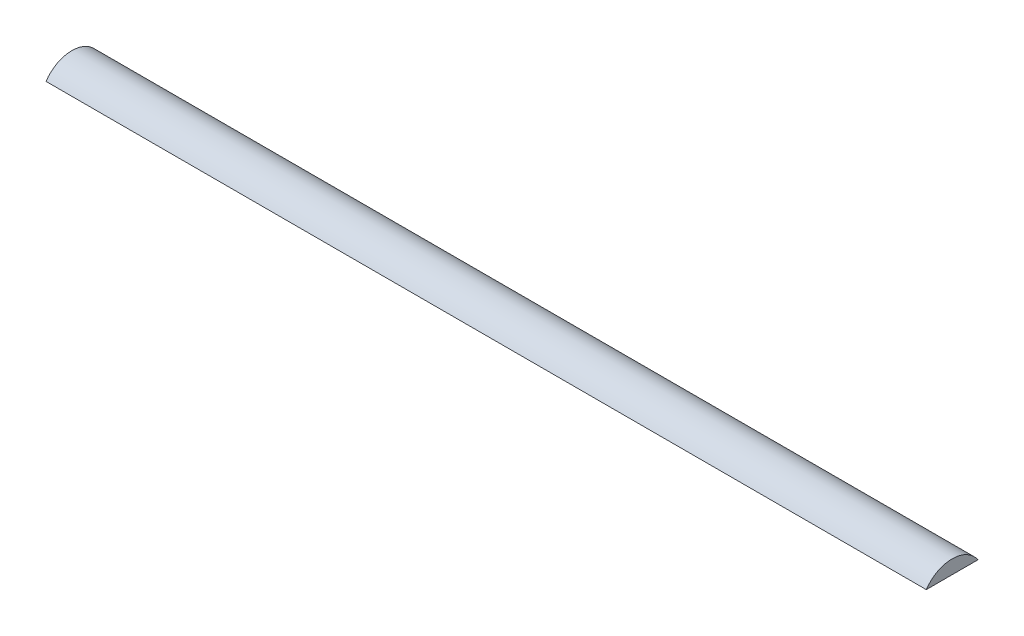
from build123d import *

# Parameters (mm, degrees)
EXTRUDE_1_DEPTH = 800


with BuildPart() as part:
    # 草图1 → 凸台-拉伸1 (new body)
    with BuildSketch(Plane(origin=(0, 0, 0), x_dir=(0, 0, -1), z_dir=(1, 0, 0))):
        with BuildLine():
            Line((23.5, 0), (-23.5, 0))
            ThreePointArc((-23.5, 0), (0, 12.5), (23.5, 0))
        make_face()
    extrude(amount=EXTRUDE_1_DEPTH)


solid = part.part
